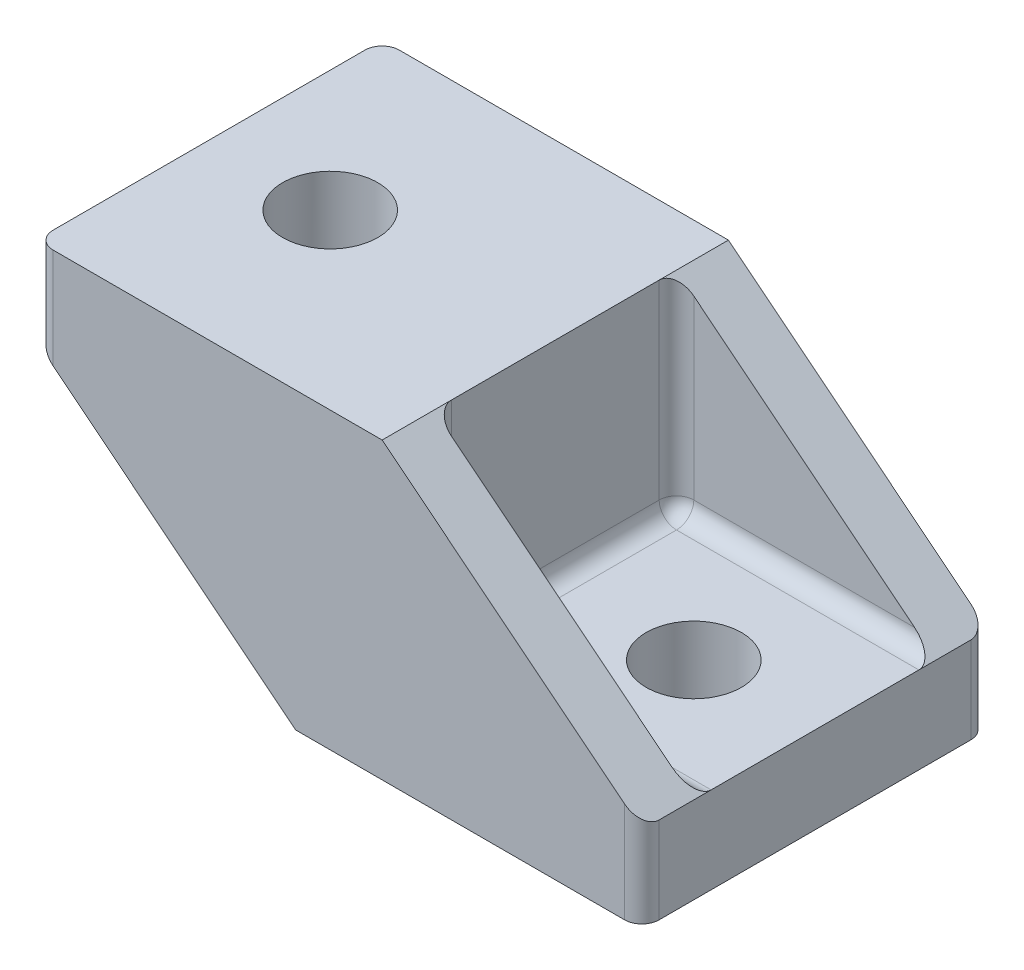
from build123d import *

# Parameters (mm, degrees)
BOSS_EXTRUDE1_DEPTH = 10
SKETCH2_R           = 2.75
CUT_EXTRUDE1_DEPTH  = 29.08914381
SKETCH3_R           = 2.75
CUT_EXTRUDE2_DEPTH  = 26.377155081
RIB7_REACH          = 35
SKETCH5_WALL_W      = 87.209372712
SKETCH5_WALL_H      = 3
RIB8_REACH          = 35
SKETCH6_WALL_W      = 87.209372712
SKETCH6_WALL_H      = 3
FILLET1_R           = 1
FILLET2_R           = 1


with BuildPart() as part:
    # Sketch1 → Boss-Extrude1 (new, symmetric)
    with BuildSketch(Plane.XY):
        Polygon((0, 0), (0, 12), (-15, 12), (-15, 17), (5, 17), (5, 5), (20, 5), (20, 0), align=None)
    extrude(amount=BOSS_EXTRUDE1_DEPTH, both=True)

    # Sketch2 → Cut-Extrude1 (cut, through all)
    with BuildSketch(Plane(origin=(0, 17, 0), x_dir=(1, 0, 0), z_dir=(0, 1, 0))):
        with Locations(Location((-8, 0, 0), (0, 0, 270))):
            Circle(SKETCH2_R)
    extrude(amount=-CUT_EXTRUDE1_DEPTH, mode=Mode.SUBTRACT)

    # Sketch3 → Cut-Extrude2 (cut, through all)
    with BuildSketch(Plane(origin=(0, 5, 0), x_dir=(1, 0, 0), z_dir=(0, 1, 0))):
        with Locations(Location((13, 0, 0), (0, 0, 180))):
            Circle(SKETCH3_R)
    extrude(amount=-CUT_EXTRUDE2_DEPTH, mode=Mode.SUBTRACT)

    # Sketch5 wall → Rib7 (add, up to next)
    with BuildSketch(Plane(origin=(12.5, 11, -10), x_dir=(-0.780868809443, 0.624695047554, 0), z_dir=(0.624695047554, 0.780868809443, 0)), mode=Mode.PRIVATE) as rib7_sk1:
        with Locations((0, 1.5)):
            Rectangle(SKETCH5_WALL_W, SKETCH5_WALL_H)
    rib7_tool1 = extrude(rib7_sk1.sketch, amount=-RIB7_REACH, mode=Mode.PRIVATE) - part.part
    rib7 = rib7_tool1.solids().sort_by_distance((12.5, 11, -10))[0]
    add(rib7)

    # Sketch6 wall → Rib8 (add, up to next)
    with BuildSketch(Plane(origin=(-7.5, 6, -10), x_dir=(0.780868809443, -0.624695047554, 0), z_dir=(-0.624695047554, -0.780868809443, 0)), mode=Mode.PRIVATE) as rib8_sk1:
        with Locations((0, 1.5)):
            Rectangle(SKETCH6_WALL_W, SKETCH6_WALL_H)
    rib8_tool1 = extrude(rib8_sk1.sketch, amount=-RIB8_REACH, mode=Mode.PRIVATE) - part.part
    rib8 = rib8_tool1.solids().sort_by_distance((-7.5, 6, -10))[0]
    add(rib8)

    # Mirror1: Rib7, Rib8 across plane
    add(rib7.mirror(Plane.XY))
    add(rib8.mirror(Plane.XY))

    # Fillet1
    fillet1_edges = [part.edges().sort_by_distance(p)[0] for p in [
        (0, 12, 0),
        (-7.5, 12, 7),
        (0, 6, 7),
        (5, 11, -7),
        (12.5, 5, -7),
        (0, 6, -7),
        (-7.5, 12, -7),
        (5, 5, 0),
        (12.5, 5, 7),
        (5, 11, 7),
    ]]
    fillet(fillet1_edges, radius=FILLET1_R)

    # Fillet2
    fillet2_edges = [part.edges().sort_by_distance(p)[0] for p in [
        (20, 2.5, -10),
        (-15, 14.5, 10),
        (20, 2.5, 10),
        (-15, 14.5, -10),
    ]]
    fillet(fillet2_edges, radius=FILLET2_R)


solid = part.part
